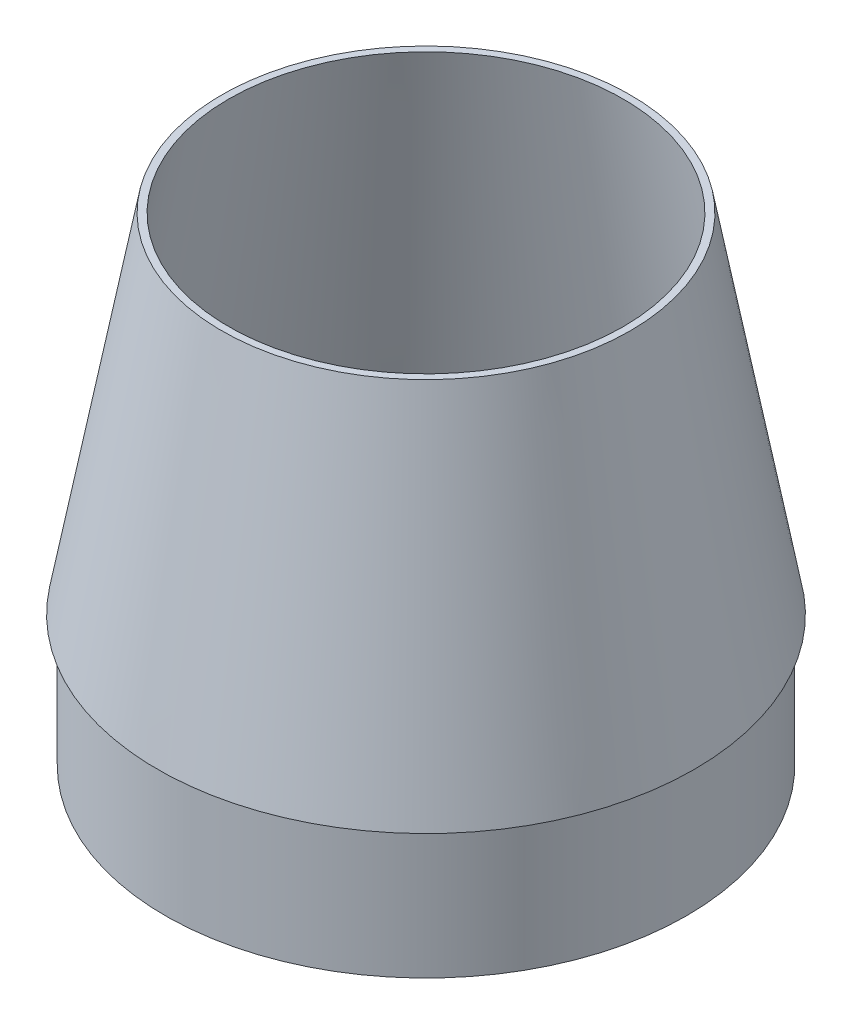
from build123d import *

# Parameters (mm, degrees)
SHELL1_T = -2.032


with BuildPart() as part:
    # Sketch1 → Revolve1 (revolve)
    with BuildSketch(Plane.XY):
        Polygon((0, 139.7), (59.6773, 139.7), (78.359, 38.1), (76.1619, 38.1), (76.1619, 0), (0, 0), align=None)
    revolve(axis=Axis((0, 0, 0), (0, 1, 0)))

    # Shell1
    shell1_openings = [part.faces().sort_by_distance(p)[0] for p in [
        (0, 0, 0),
        (0, 139.7, 0),
    ]]
    offset(amount=SHELL1_T, openings=shell1_openings, kind=Kind.INTERSECTION)


solid = part.part
